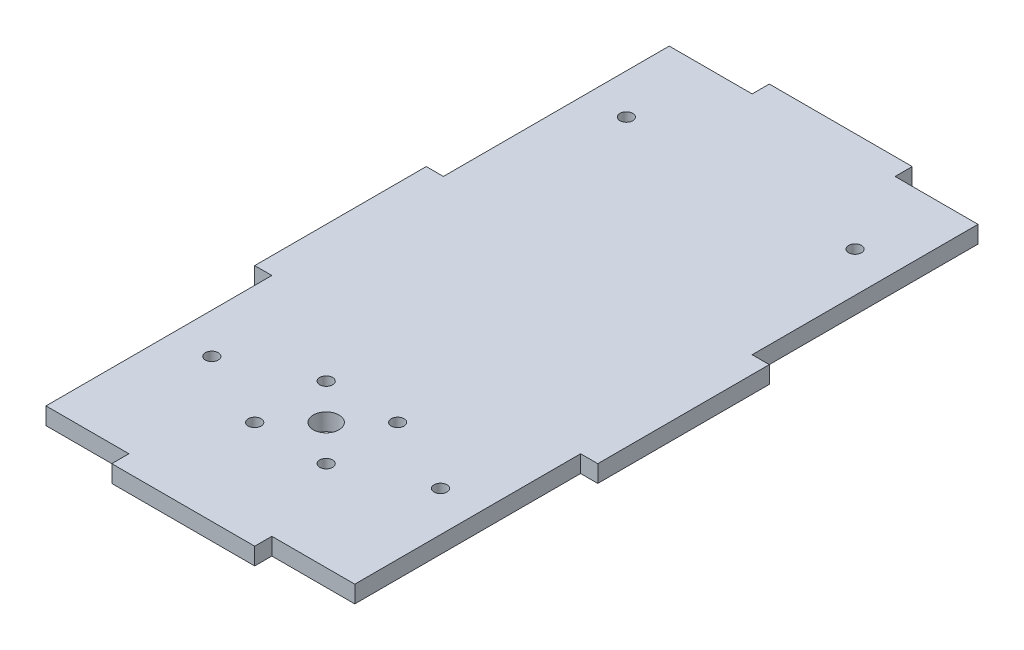
from build123d import *

# Parameters (mm, degrees)
SALIENTE_EXTRUIR1_DEPTH      = 3
CORTAR_EXTRUIR1_DEPTH        = 130.745905523
CORTAR_EXTRUIR1_DEPTH_BACK   = 130.745905523
CROQUIS2_R                   = 4.5
TALADRO_DE_MARGEN_PARA_M42_D = 4.5
TALADRO_DE_MARGEN_PARA_M41_D = 4.5


with BuildPart() as part:
    # Croquis1 → Saliente-Extruir1 (new, symmetric)
    with BuildSketch(Plane(origin=(0, 0, 0), x_dir=(1, 0, 0), z_dir=(0, 1, 0))):
        Polygon((-54, -109), (-25, -109), (-25, -115), (25, -115), (25, -109), (54, -109), (54, -30), (60, -30), (60, 30), (54, 30), (54, 109), (25, 109), (25, 115), (-25, 115), (-25, 109), (-54, 109), (-54, 30), (-60, 30), (-60, -30), (-54, -30), align=None)
    extrude(amount=SALIENTE_EXTRUIR1_DEPTH, both=True)

    # Croquis2 → Cortar-Extruir1 (cut, two sides: drawn at the far end of the back side and taken through both)
    with BuildSketch(Plane(origin=(0, 0, 0), x_dir=(1, 0, 0), z_dir=(0, 1, 0)).offset(-CORTAR_EXTRUIR1_DEPTH_BACK)):
        with Locations(Location((0, -65, 0), (0, 0, 270))):
            Circle(CROQUIS2_R)
    extrude(amount=CORTAR_EXTRUIR1_DEPTH + CORTAR_EXTRUIR1_DEPTH_BACK, mode=Mode.SUBTRACT)

    # Taladro de margen para M42 (through all)
    with Locations(Plane(origin=(0, 3, 0), x_dir=(1, 0, 0), z_dir=(0, 1, 0))):
        with Locations((12.5, -77.5), (-12.5, -77.5), (12.5, -52.5), (-12.5, -52.5)):
            Hole(TALADRO_DE_MARGEN_PARA_M42_D / 2)

    # Taladro de margen para M41 (through all)
    with Locations(Plane(origin=(0, -3, 0), x_dir=(-1, 0, 0), z_dir=(0, -1, 0))):
        with Locations((40, 80), (-40, 80), (40, -65), (-40, -65)):
            Hole(TALADRO_DE_MARGEN_PARA_M41_D / 2)


solid = part.part
